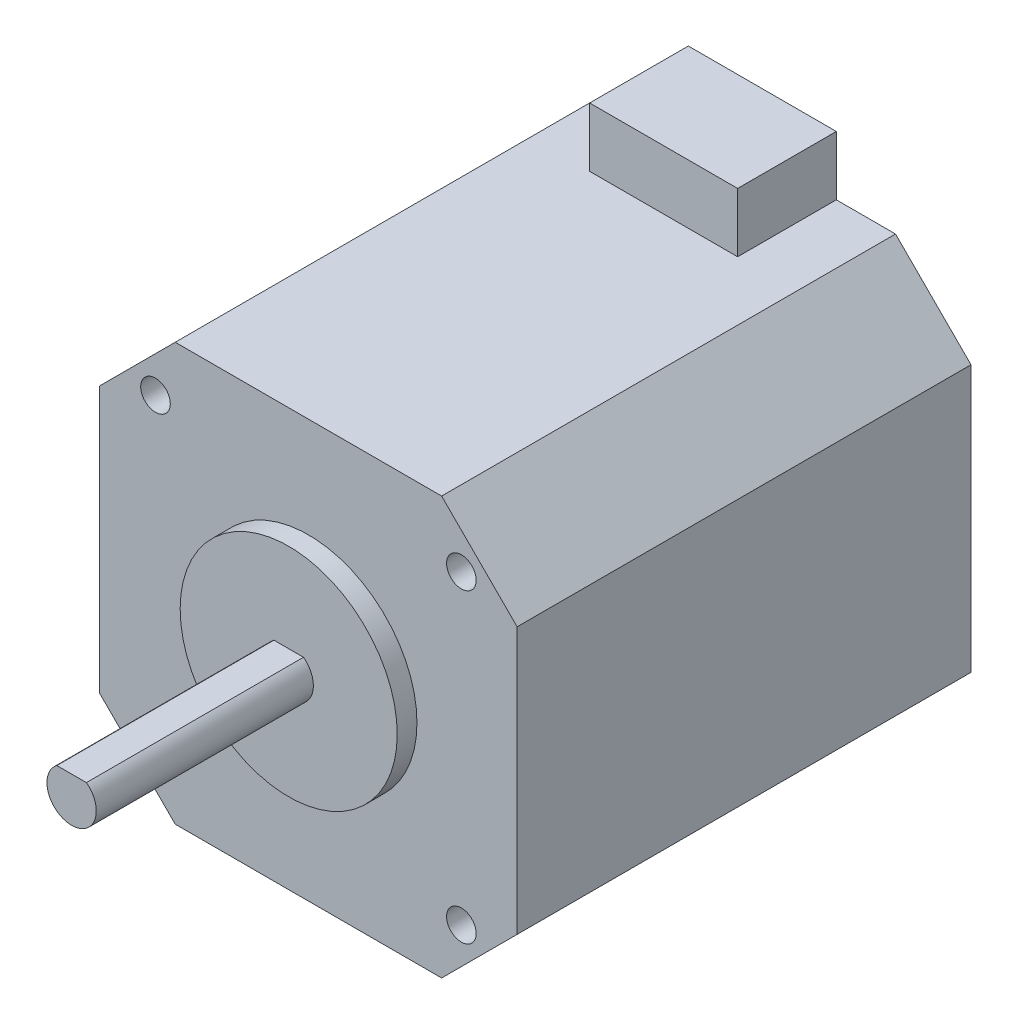
from build123d import *

# Parameters (mm, degrees)
BOSS_EXTRUDE1_DEPTH = 46
SKETCH3_R           = 11
BOSS_EXTRUDE2_DEPTH = 2
SKETCH4_R           = 2.5
BOSS_EXTRUDE3_DEPTH = 22
CUT_EXTRUDE1_START  = -22
CUT_EXTRUDE1_DEPTH  = 22
SKETCH6_R           = 1.5
CUT_EXTRUDE2_DEPTH  = 4.5
SKETCH7_W           = 15
SKETCH7_H           = 10
BOSS_EXTRUDE4_DEPTH = 6


with BuildPart() as part:
    # Sketch1 → Boss-Extrude1 (new body)
    with BuildSketch(Plane.XY):
        Polygon((7.65, 0), (0, 7.65), (0, 34.65), (7.65, 42.3), (34.65, 42.3), (42.3, 34.65), (42.3, 7.65), (34.65, 0), align=None)
    extrude(amount=BOSS_EXTRUDE1_DEPTH)

    # Sketch3 → Boss-Extrude2 (add)
    with BuildSketch(Plane.XY.offset(46)):
        with Locations((21.15, 21.15)):
            Circle(SKETCH3_R)
    extrude(amount=BOSS_EXTRUDE2_DEPTH)

    # Sketch4 → Boss-Extrude3 (add)
    with BuildSketch(Plane.XY.offset(48)):
        with Locations((21.15, 21.15)):
            Circle(SKETCH4_R)
    extrude(amount=BOSS_EXTRUDE3_DEPTH)

    # Sketch5 → Cut-Extrude1 (cut)
    with BuildSketch(Plane.XY.offset(70).offset(CUT_EXTRUDE1_START)):
        with BuildLine():
            Line((21.15, 23.15), (22.65, 23.15))
            ThreePointArc((22.65, 23.15), (21.15, 23.65), (19.65, 23.15))
            Line((19.65, 23.15), (21.15, 23.15))
        make_face()
    extrude(amount=CUT_EXTRUDE1_DEPTH, mode=Mode.SUBTRACT)

    # Sketch6 → Cut-Extrude2 (cut)
    with BuildSketch(Plane.XY.offset(46)):
        with Locations((5.65, 5.65)):
            Circle(SKETCH6_R)
        with Locations((5.65, 36.65)):
            Circle(SKETCH6_R)
        with Locations(Location((36.65, 5.65, 0), (0, 0, 180))):
            Circle(SKETCH6_R)
        with Locations(Location((36.65, 36.65, 0), (0, 0, 180))):
            Circle(SKETCH6_R)
    extrude(amount=-CUT_EXTRUDE2_DEPTH, mode=Mode.SUBTRACT)

    # Sketch7 → Boss-Extrude4 (add)
    with BuildSketch(Plane(origin=(0, 42.3, 0), x_dir=(1, 0, 0), z_dir=(0, 1, 0))):
        with Locations((21.15, -5)):
            Rectangle(SKETCH7_W, SKETCH7_H)
    extrude(amount=BOSS_EXTRUDE4_DEPTH)


solid = part.part
